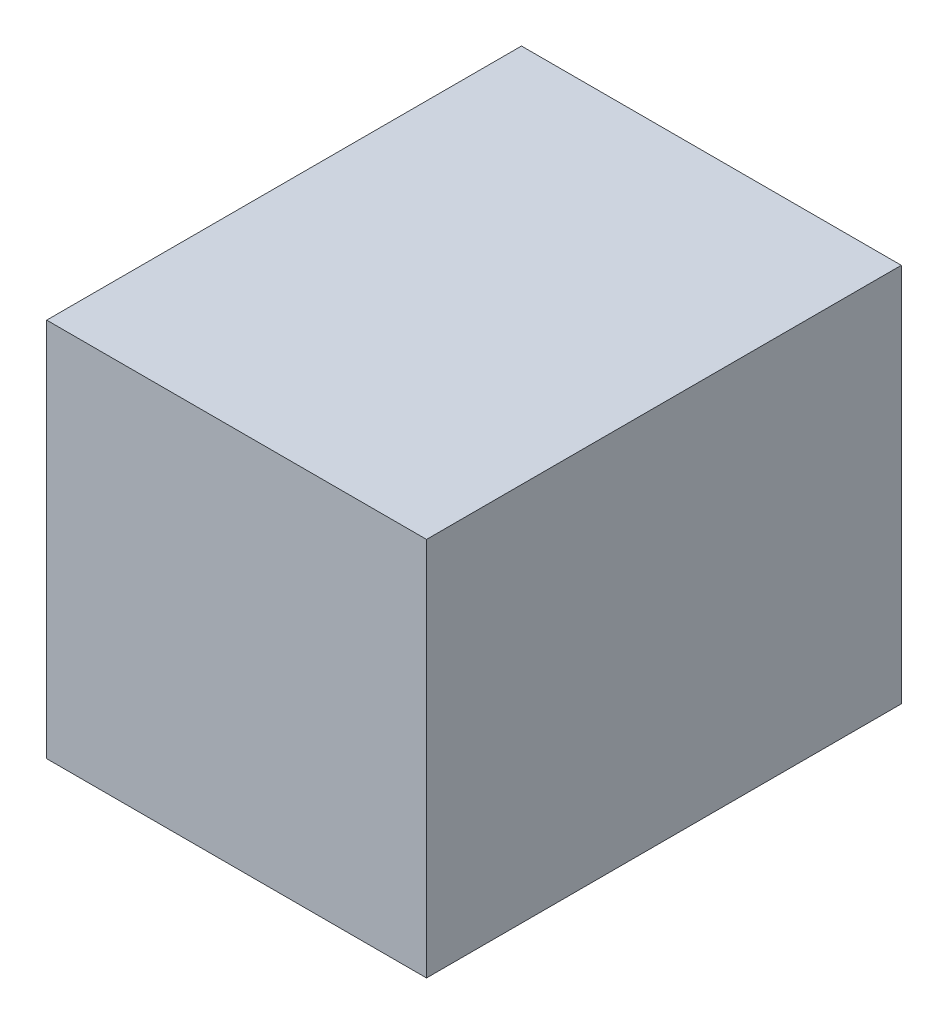
from build123d import *

# Parameters (mm, degrees)
SKETCH_1_W        = 160
SKETCH_1_H        = 200
EXTRUDE_267_DEPTH = 160


with BuildPart() as part:
    # 草圖1 → Extrude 267 (new body)
    with BuildSketch(Plane(origin=(0, 0, 0), x_dir=(1, 0, 0), z_dir=(0, 1, 0))):
        Rectangle(SKETCH_1_W, SKETCH_1_H)
    extrude(amount=EXTRUDE_267_DEPTH)


solid = part.part
